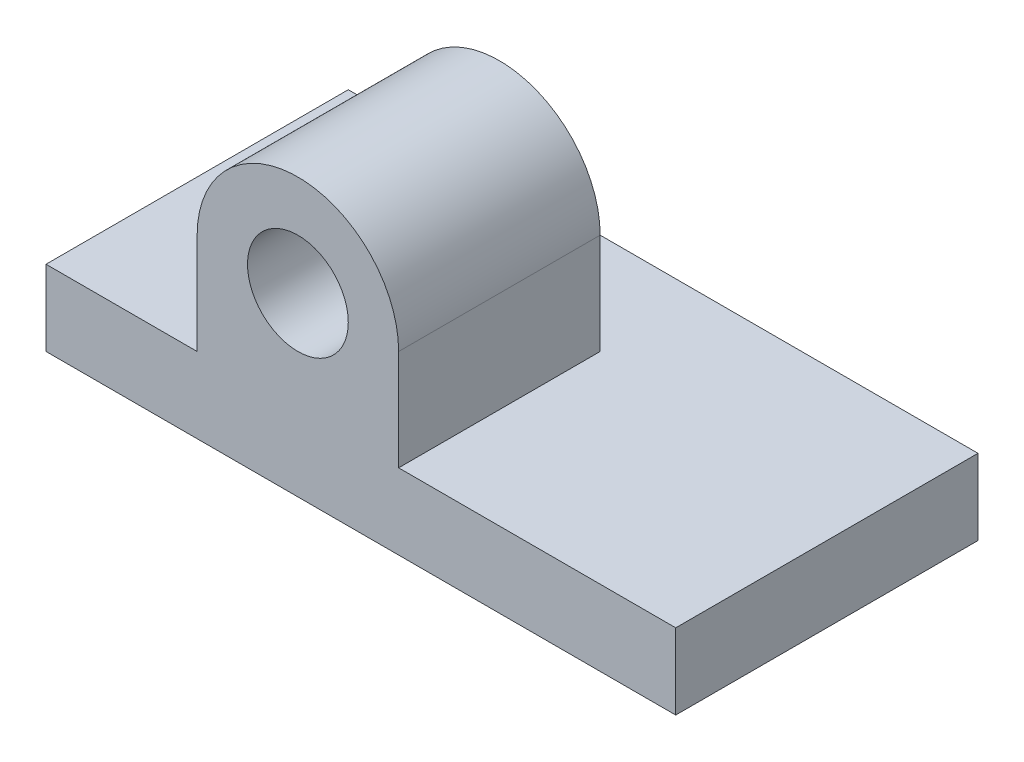
from build123d import *

# Parameters (mm, degrees)
SKETCH1_R           = 10
BOSS_EXTRUDE1_DEPTH = 60
SKETCH2_W           = 20
SKETCH2_H           = 40
CUT_EXTRUDE1_DEPTH  = 150.164338902


with BuildPart() as part:
    # Sketch1 → Boss-Extrude1 (new body)
    with BuildSketch(Plane.XY):
        with BuildLine():
            Line((30, 35), (30, 15))
            Line((30, 15), (0, 15))
            Line((0, 15), (0, 0))
            Line((0, 0), (125, 0))
            Line((125, 0), (125, 15))
            Line((125, 15), (70, 15))
            Line((70, 15), (70, 35))
            ThreePointArc((70, 35), (50, 55), (30, 35))
        make_face()
        with Locations((50, 35)):
            Circle(SKETCH1_R, mode=Mode.SUBTRACT)
    extrude(amount=-BOSS_EXTRUDE1_DEPTH)

    # Sketch2 → Cut-Extrude1 (cut, through all)
    with BuildSketch(Plane(origin=(0, 0, 0), x_dir=(0, 0, -1), z_dir=(1, 0, 0))):
        with Locations((50, 35)):
            Rectangle(SKETCH2_W, SKETCH2_H)
    extrude(amount=CUT_EXTRUDE1_DEPTH, mode=Mode.SUBTRACT)


solid = part.part
